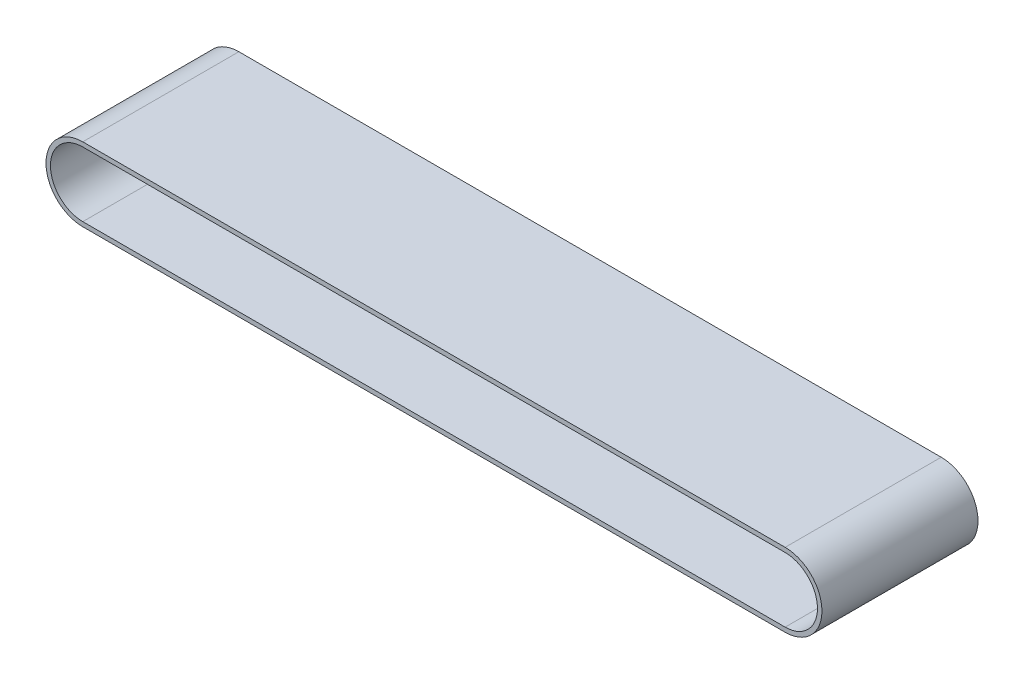
from build123d import *

# Parameters (mm, degrees)
EXTRUIR_L_MINA1_DEPTH = 35


with BuildPart() as part:
    # Croquis2 → Extruir-Lámina1 (new, symmetric)
    with BuildSketch(Plane.XY):
        with BuildLine():
            Line((0, -12.5), (-315, -12.5))
            ThreePointArc((-315, -12.5), (-331.5, 4), (-315, 20.5))
            Line((-315, 20.5), (0, 20.5))
            ThreePointArc((0, 20.5), (16.5, 4), (0, -12.5))
        make_face()
        with BuildLine():
            Line((0, -10.5), (-315, -10.5))
            ThreePointArc((-315, -10.5), (-329.5, 4), (-315, 18.5))
            Line((-315, 18.5), (0, 18.5))
            ThreePointArc((0, 18.5), (14.5, 4), (0, -10.5))
        make_face(mode=Mode.SUBTRACT)
    extrude(amount=EXTRUIR_L_MINA1_DEPTH, both=True)


solid = part.part
